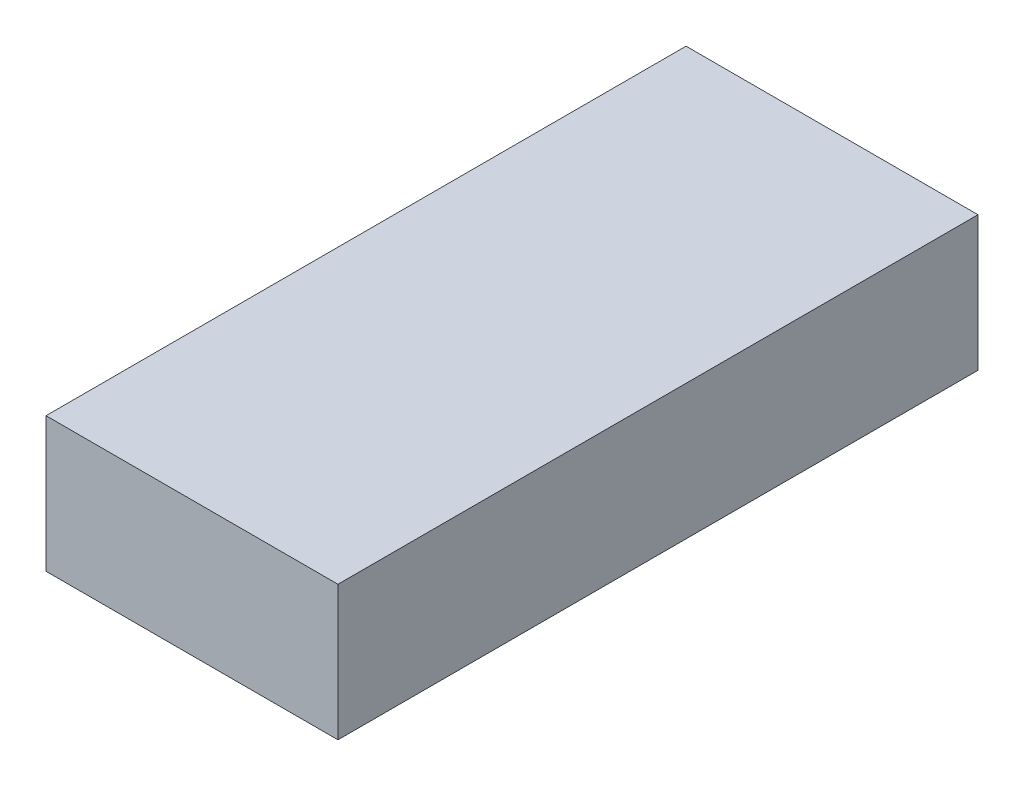
from build123d import *

# Parameters (mm, degrees)
SKETCH1_W           = 26
SKETCH1_H           = 12
BOSS_EXTRUDE1_DEPTH = 57


with BuildPart() as part:
    # Sketch1 → Boss-Extrude1 (new body)
    with BuildSketch(Plane.XY):
        with Locations((13, 6)):
            Rectangle(SKETCH1_W, SKETCH1_H)
    extrude(amount=BOSS_EXTRUDE1_DEPTH)


solid = part.part
